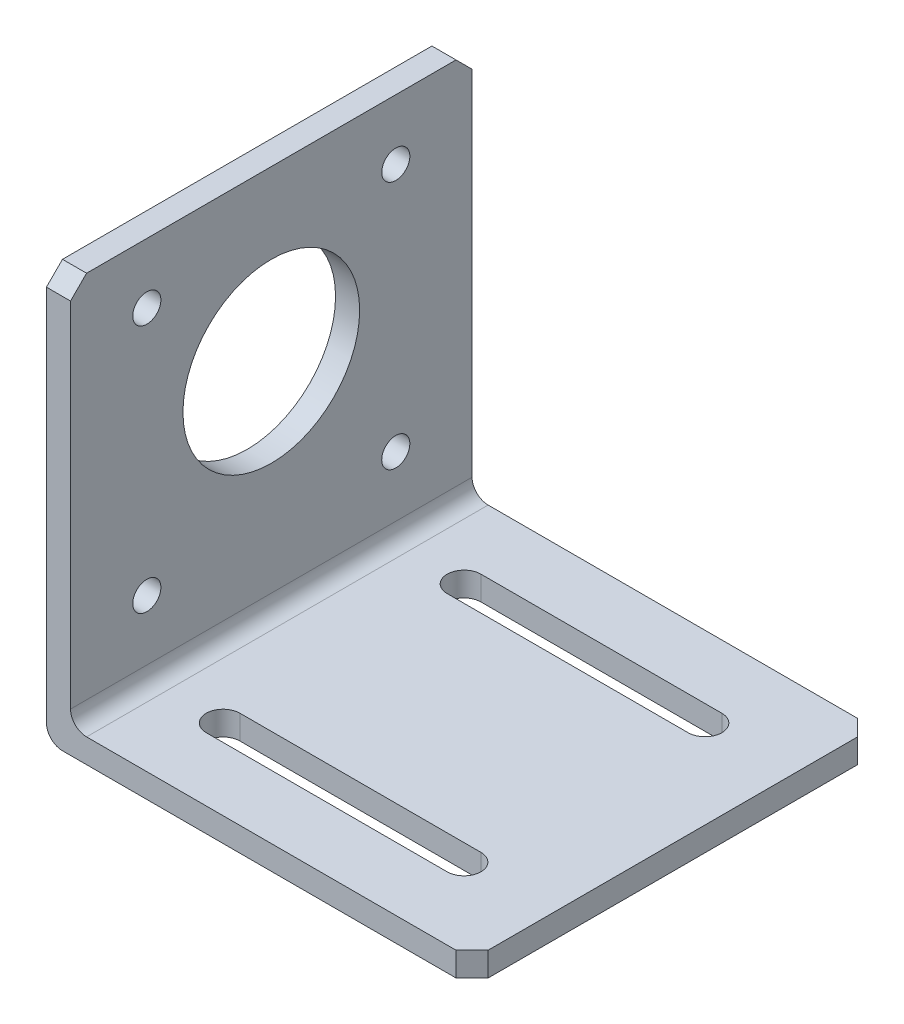
from build123d import *

# Parameters (mm, degrees)
Y_KSEKLIK_EKSTR_ZYON1_DEPTH = 50
IZIM2_R                     = 11
IZIM2_R_2                   = 1.75
KES_EKSTR_ZYON1_DEPTH       = 88.183714076
KES_EKSTR_ZYON2_DEPTH       = 88.252507127
KES_EKSTR_ZYON2_DEPTH_BACK  = 10
KES_EKSTR_ZYON3_DEPTH       = 88.183714076
KES_EKSTR_ZYON4_DEPTH       = 88.252507127


with BuildPart() as part:
    # Çizim1 → Yükseklik-Ekstrüzyon1 (new body)
    with BuildSketch(Plane.XY):
        with BuildLine():
            Line((0, 51), (0, 2))
            ThreePointArc((0, 2), (0.585786438, 0.585786438), (2, 0))
            Line((2, 0), (53, 0))
            Line((53, 0), (53, 3))
            Line((53, 3), (5, 3))
            ThreePointArc((5, 3), (3.585786438, 3.585786438), (3, 5))
            Line((3, 5), (3, 51))
            Line((3, 51), (0, 51))
        make_face()
    extrude(amount=Y_KSEKLIK_EKSTR_ZYON1_DEPTH)

    # Çizim2 → Kes-Ekstrüzyon1 (cut, through all)
    with BuildSketch(Plane(origin=(3, 0, 0), x_dir=(0, 0, -1), z_dir=(1, 0, 0))):
        with Locations((-25, 30)):
            Circle(IZIM2_R)
        with Locations((-9.5, 43.5)):
            Circle(IZIM2_R_2)
        with Locations(Location((-40.5, 43.5, 0), (0, 0, 180))):
            Circle(IZIM2_R_2)
        with Locations(Location((-9.5, 12.5, 0), (0, 0, 180))):
            Circle(IZIM2_R_2)
        with Locations((-40.5, 12.5)):
            Circle(IZIM2_R_2)
    extrude(amount=-KES_EKSTR_ZYON1_DEPTH, mode=Mode.SUBTRACT)

    # Çizim3 → Kes-Ekstrüzyon2 (cut, two sides: drawn at the far end of the back side and taken through both)
    with BuildSketch(Plane(origin=(0, 3, 0), x_dir=(1, 0, 0), z_dir=(0, 1, 0)).offset(-KES_EKSTR_ZYON2_DEPTH_BACK)):
        with BuildLine():
            Line((42, -12.1), (12, -12.1))
            ThreePointArc((12, -12.1), (9.9, -10), (12, -7.9))
            Line((12, -7.9), (42, -7.9))
            ThreePointArc((42, -7.9), (44.1, -10), (42, -12.1))
        make_face()
        with BuildLine():
            Line((42, -37.9), (12, -37.9))
            ThreePointArc((12, -37.9), (9.9, -40), (12, -42.1))
            Line((12, -42.1), (42, -42.1))
            ThreePointArc((42, -42.1), (44.1, -40), (42, -37.9))
        make_face()
    extrude(amount=KES_EKSTR_ZYON2_DEPTH + KES_EKSTR_ZYON2_DEPTH_BACK, mode=Mode.SUBTRACT)

    # Çizim4 → Kes-Ekstrüzyon3 (cut, through all)
    with BuildSketch(Plane(origin=(3, 0, 0), x_dir=(0, 0, -1), z_dir=(1, 0, 0))):
        Polygon((-50, 49), (-50, 51), (-48, 51), align=None)
        Polygon((0, 49), (0, 51), (-2, 51), align=None)
    extrude(amount=-KES_EKSTR_ZYON3_DEPTH, mode=Mode.SUBTRACT)

    # Çizim5 → Kes-Ekstrüzyon4 (cut, through all)
    with BuildSketch(Plane(origin=(0, 3, 0), x_dir=(1, 0, 0), z_dir=(0, 1, 0))):
        Polygon((53, -48), (51, -50), (53, -50), align=None)
        Polygon((53, 0), (53, -2), (51, 0), align=None)
    extrude(amount=-KES_EKSTR_ZYON4_DEPTH, mode=Mode.SUBTRACT)


solid = part.part
